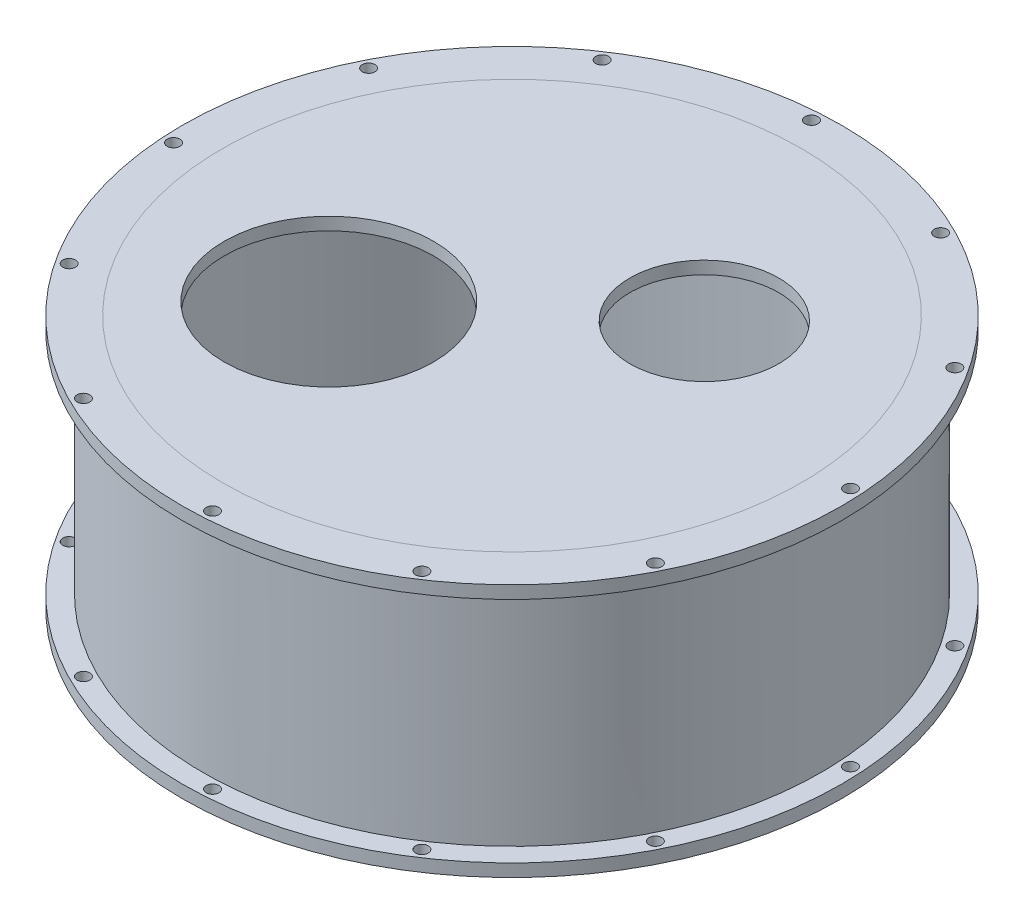
from build123d import *

# Parameters (mm, degrees)
SKETCH1_R           = 155
SKETCH1_R_2         = 145
BOSS_EXTRUDE1_DEPTH = 63.5
SKETCH2_R           = 165.16
SKETCH2_R_2         = 155
BOSS_EXTRUDE2_DEPTH = 6.35
SKETCH3_R           = 145
SKETCH3_R_2         = 37.277426073
SKETCH3_R_3         = 52.443744705
BOSS_EXTRUDE4_DEPTH = 6.35
CIRPATTERN2_COUNT   = 12


with BuildPart() as part:
    # Sketch1 → Boss-Extrude1 (new body)
    with BuildSketch(Plane(origin=(0, 0, 0), x_dir=(1, 0, 0), z_dir=(0, 1, 0))):
        with Locations(Location((0, 0, 0), (0, 0, 270))):
            Circle(SKETCH1_R)
        with Locations(Location((0, 0, 0), (0, 0, 270))):
            Circle(SKETCH1_R_2, mode=Mode.SUBTRACT)
    boss_extrude1 = extrude(amount=BOSS_EXTRUDE1_DEPTH)

    # Sketch2 → Boss-Extrude2 (add)
    with BuildSketch(Plane.XZ):
        with Locations(Location((0, 0, 0), (0, 0, 270))):
            Circle(SKETCH2_R)
        with Locations(Location((0, 0, 0), (0, 0, 270))):
            Circle(SKETCH2_R_2, mode=Mode.SUBTRACT)
    boss_extrude2 = extrude(amount=-BOSS_EXTRUDE2_DEPTH)

    # Mirror2: Boss-Extrude1, Boss-Extrude2 across plane
    add(boss_extrude1.mirror(Plane.ZX.offset(63.5)))
    add(boss_extrude2.mirror(Plane.ZX.offset(63.5)))

    # Sketch10 → 1/4 (0.25) Diameter Hole2 (revolve, cut)
    with BuildSketch(Plane(origin=(9.767093679, 127, 159.781758286), x_dir=(0, 0, 1), z_dir=(1, 0, 0))):
        Polygon((0, 0), (0, 8.257732465), (3.175, 6.35), (3.175, 0), align=None)
    f_1_4_0_25_diameter_hole2 = revolve(axis=Axis((9.767093679, 133.35, 159.781758286), (0, -1, 0)), mode=Mode.SUBTRACT)

    # Mirror6: 1/4 (0.25) Diameter Hole2 across plane
    add(f_1_4_0_25_diameter_hole2.mirror(Plane.ZX.offset(63.5)), mode=Mode.SUBTRACT)

    # CirPattern2: 1/4 (0.25) Diameter Hole2 ×12 about axis
    cirpattern2_axis = Axis((0, 0, 0), (0, 1, 0))
    for i in range(1, CIRPATTERN2_COUNT):
        add(f_1_4_0_25_diameter_hole2.rotate(cirpattern2_axis, i * 360 / CIRPATTERN2_COUNT), mode=Mode.SUBTRACT)

    # CirPattern2 copy 1 sketch → CirPattern2 copy 1 (revolve, cut)
    with BuildSketch(Plane(origin=(88.349430391, 0, 133.491514898), x_dir=(0.49999999999999994, 0, 0.8660254037844387), z_dir=(0.8660254037844387, 0, -0.49999999999999994))):
        Polygon((0, 0), (0, -8.257732465), (3.175, -6.35), (3.175, 0), align=None)
    revolve(axis=Axis((88.349430391, -6.35, 133.491514898), (0, -1, 0)), mode=Mode.SUBTRACT)

    # CirPattern2 copy 2 sketch → CirPattern2 copy 2 (revolve, cut)
    with BuildSketch(Plane(origin=(143.258608577, 0, 71.432327896), x_dir=(0.8660254037844386, 0, 0.5000000000000001), z_dir=(0.5000000000000001, 0, -0.8660254037844386))):
        Polygon((0, 0), (0, -8.257732465), (3.175, -6.35), (3.175, 0), align=None)
    revolve(axis=Axis((143.258608577, -6.35, 71.432327896), (0, -1, 0)), mode=Mode.SUBTRACT)

    # CirPattern2 copy 3 sketch → CirPattern2 copy 3 (revolve, cut)
    with BuildSketch(Plane(origin=(159.781758286, 0, -9.767093679), x_dir=(1, 0, 0), z_dir=(0, 0, -1))):
        Polygon((0, 0), (0, -8.257732465), (3.175, -6.35), (3.175, 0), align=None)
    revolve(axis=Axis((159.781758286, -6.35, -9.767093679), (0, -1, 0)), mode=Mode.SUBTRACT)

    # CirPattern2 copy 4 sketch → CirPattern2 copy 4 (revolve, cut)
    with BuildSketch(Plane(origin=(133.491514898, 0, -88.349430391), x_dir=(0.8660254037844387, 0, -0.4999999999999998), z_dir=(-0.4999999999999998, 0, -0.8660254037844387))):
        Polygon((0, 0), (0, -8.257732465), (3.175, -6.35), (3.175, 0), align=None)
    revolve(axis=Axis((133.491514898, -6.35, -88.349430391), (0, -1, 0)), mode=Mode.SUBTRACT)

    # CirPattern2 copy 5 sketch → CirPattern2 copy 5 (revolve, cut)
    with BuildSketch(Plane(origin=(71.432327896, 0, -143.258608577), x_dir=(0.49999999999999994, 0, -0.8660254037844387), z_dir=(-0.8660254037844387, 0, -0.49999999999999994))):
        Polygon((0, 0), (0, -8.257732465), (3.175, -6.35), (3.175, 0), align=None)
    revolve(axis=Axis((71.432327896, -6.35, -143.258608577), (0, -1, 0)), mode=Mode.SUBTRACT)

    # CirPattern2 copy 6 sketch → CirPattern2 copy 6 (revolve, cut)
    with BuildSketch(Plane(origin=(-9.767093679, 0, -159.781758286), x_dir=(0, 0, -1), z_dir=(-1, 0, 0))):
        Polygon((0, 0), (0, -8.257732465), (3.175, -6.35), (3.175, 0), align=None)
    revolve(axis=Axis((-9.767093679, -6.35, -159.781758286), (0, -1, 0)), mode=Mode.SUBTRACT)

    # CirPattern2 copy 7 sketch → CirPattern2 copy 7 (revolve, cut)
    with BuildSketch(Plane(origin=(-88.349430391, 0, -133.491514898), x_dir=(-0.5000000000000001, 0, -0.8660254037844386), z_dir=(-0.8660254037844386, 0, 0.5000000000000001))):
        Polygon((0, 0), (0, -8.257732465), (3.175, -6.35), (3.175, 0), align=None)
    revolve(axis=Axis((-88.349430391, -6.35, -133.491514898), (0, -1, 0)), mode=Mode.SUBTRACT)

    # CirPattern2 copy 8 sketch → CirPattern2 copy 8 (revolve, cut)
    with BuildSketch(Plane(origin=(-143.258608577, 0, -71.432327896), x_dir=(-0.8660254037844384, 0, -0.5000000000000004), z_dir=(-0.5000000000000004, 0, 0.8660254037844384))):
        Polygon((0, 0), (0, -8.257732465), (3.175, -6.35), (3.175, 0), align=None)
    revolve(axis=Axis((-143.258608577, -6.35, -71.432327896), (0, -1, 0)), mode=Mode.SUBTRACT)

    # CirPattern2 copy 9 sketch → CirPattern2 copy 9 (revolve, cut)
    with BuildSketch(Plane(origin=(-159.781758286, 0, 9.767093679), x_dir=(-1, 0, 0), z_dir=(0, 0, 1))):
        Polygon((0, 0), (0, -8.257732465), (3.175, -6.35), (3.175, 0), align=None)
    revolve(axis=Axis((-159.781758286, -6.35, 9.767093679), (0, -1, 0)), mode=Mode.SUBTRACT)

    # CirPattern2 copy 10 sketch → CirPattern2 copy 10 (revolve, cut)
    with BuildSketch(Plane(origin=(-133.491514898, 0, 88.349430391), x_dir=(-0.8660254037844386, 0, 0.5000000000000001), z_dir=(0.5000000000000001, 0, 0.8660254037844386))):
        Polygon((0, 0), (0, -8.257732465), (3.175, -6.35), (3.175, 0), align=None)
    revolve(axis=Axis((-133.491514898, -6.35, 88.349430391), (0, -1, 0)), mode=Mode.SUBTRACT)

    # CirPattern2 copy 11 sketch → CirPattern2 copy 11 (revolve, cut)
    with BuildSketch(Plane(origin=(-71.432327896, 0, 143.258608577), x_dir=(-0.5000000000000004, 0, 0.8660254037844384), z_dir=(0.8660254037844384, 0, 0.5000000000000004))):
        Polygon((0, 0), (0, -8.257732465), (3.175, -6.35), (3.175, 0), align=None)
    revolve(axis=Axis((-71.432327896, -6.35, 143.258608577), (0, -1, 0)), mode=Mode.SUBTRACT)


with BuildPart() as body_2:
    # Sketch3 → Boss-Extrude4 (new body)
    with BuildSketch(Plane(origin=(0, 127, 0), x_dir=(1, 0, 0), z_dir=(0, 1, 0))):
        with Locations(Location((0, 0, 0), (0, 0, 270))):
            Circle(SKETCH3_R)
        with Locations(Location((50.436816268, 45.895311145, 0), (0, 0, 270))):
            Circle(SKETCH3_R_2, mode=Mode.SUBTRACT)
        with Locations(Location((-51.935843859, -39.800539592, 0), (0, 0, 270))):
            Circle(SKETCH3_R_3, mode=Mode.SUBTRACT)
    extrude(amount=-BOSS_EXTRUDE4_DEPTH)


solid = Compound([part.part, body_2.part])
